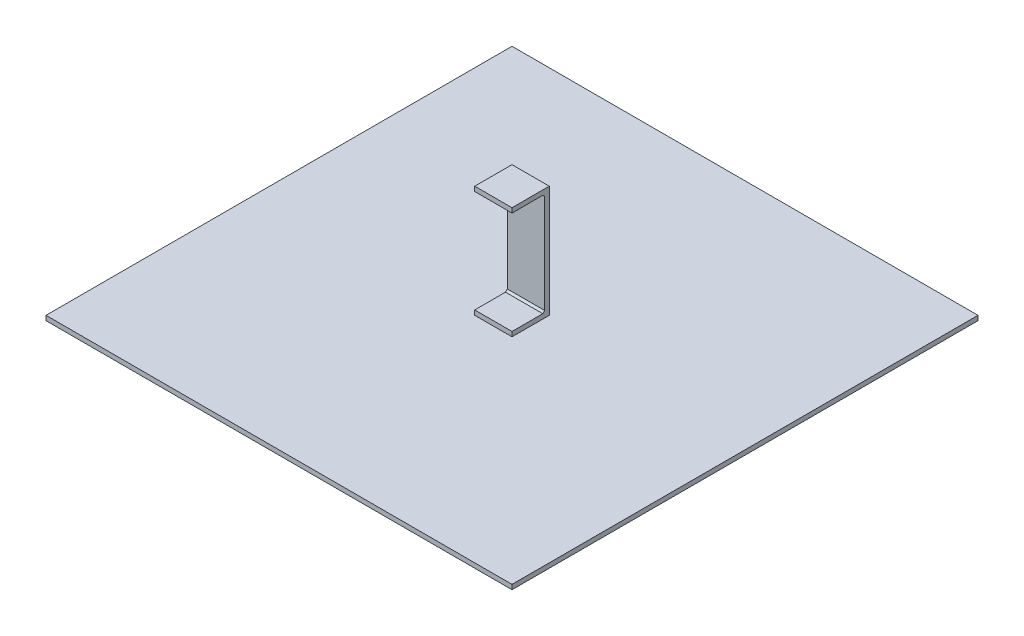
from build123d import *

# Parameters (mm, degrees)
BOSS_EXTRUDE1_DEPTH = 400
CHAMFER1_SIZE       = 20
SKETCH2_W           = 5000
SKETCH2_H           = 5000
SKETCH2_W_2         = 400
SKETCH2_H_2         = 400
BOSS_EXTRUDE2_DEPTH = 50


with BuildPart() as part:
    # Sketch1 → Boss-Extrude1 (new body)
    with BuildSketch(Plane(origin=(0, 0, 0), x_dir=(0, 0, -1), z_dir=(1, 0, 0))):
        Polygon((-104.985169381, 50), (295.014830619, 50), (295.014830619, -1150), (-104.985169381, -1150), (-104.985169381, -1100), (245.014830619, -1100), (245.014830619, 0), (-104.985169381, 0), align=None)
    extrude(amount=BOSS_EXTRUDE1_DEPTH)

    # Chamfer1
    chamfer1_edges = [part.edges().sort_by_distance(p)[0] for p in [
        (200, -1100, -245.014830619),
        (200, 0, -245.014830619),
    ]]
    chamfer(chamfer1_edges, length=CHAMFER1_SIZE)


with BuildPart() as body_2:
    # Sketch2 → Boss-Extrude2 (new body)
    with BuildSketch(Plane.XZ.offset(1150)):
        with Locations((200, -95.014830619)):
            Rectangle(SKETCH2_W, SKETCH2_H)
        with Locations((200, -95.014830619)):
            Rectangle(SKETCH2_W_2, SKETCH2_H_2, mode=Mode.SUBTRACT)
    extrude(amount=BOSS_EXTRUDE2_DEPTH)


solid = Compound([part.part, body_2.part])
